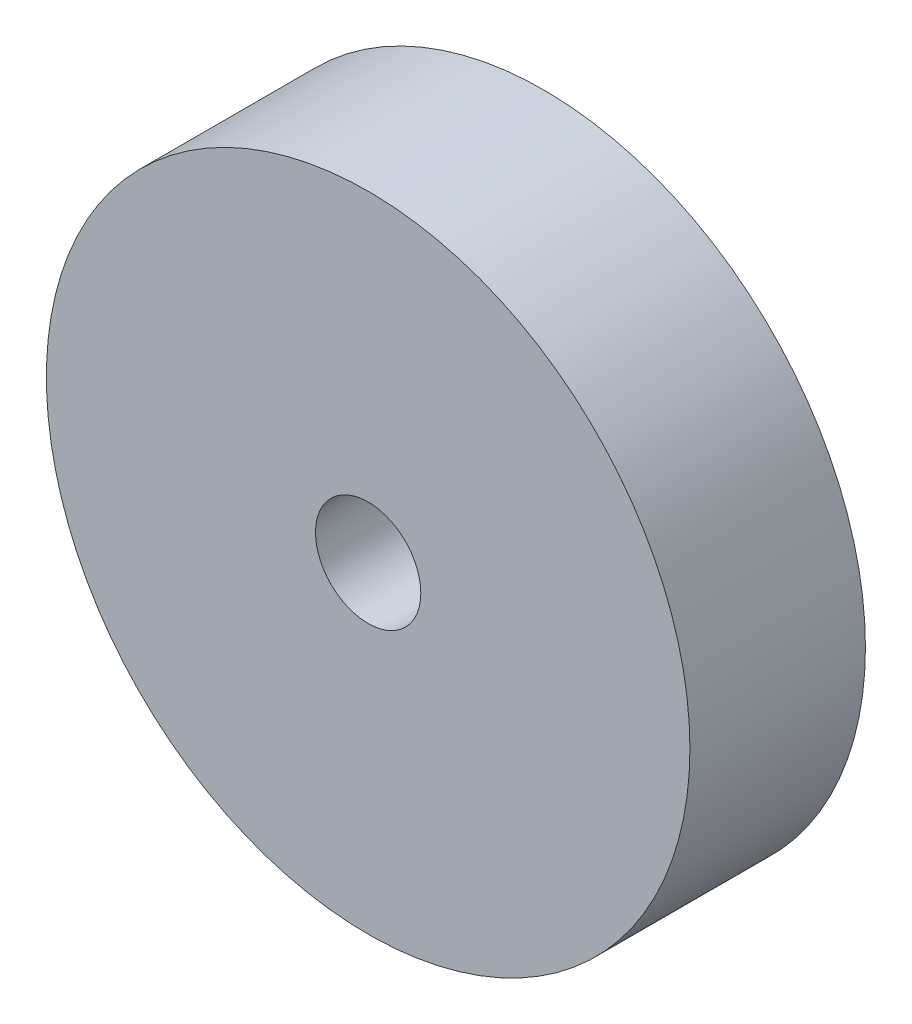
from build123d import *

# Parameters (mm, degrees)
SKETCH1_R           = 5.5
SKETCH1_R_2         = 0.9
BOSS_EXTRUDE1_DEPTH = 3


with BuildPart() as part:
    # Sketch1 → Boss-Extrude1 (new body)
    with BuildSketch(Plane.XY):
        Circle(SKETCH1_R)
        Circle(SKETCH1_R_2, mode=Mode.SUBTRACT)
    extrude(amount=BOSS_EXTRUDE1_DEPTH)


solid = part.part
